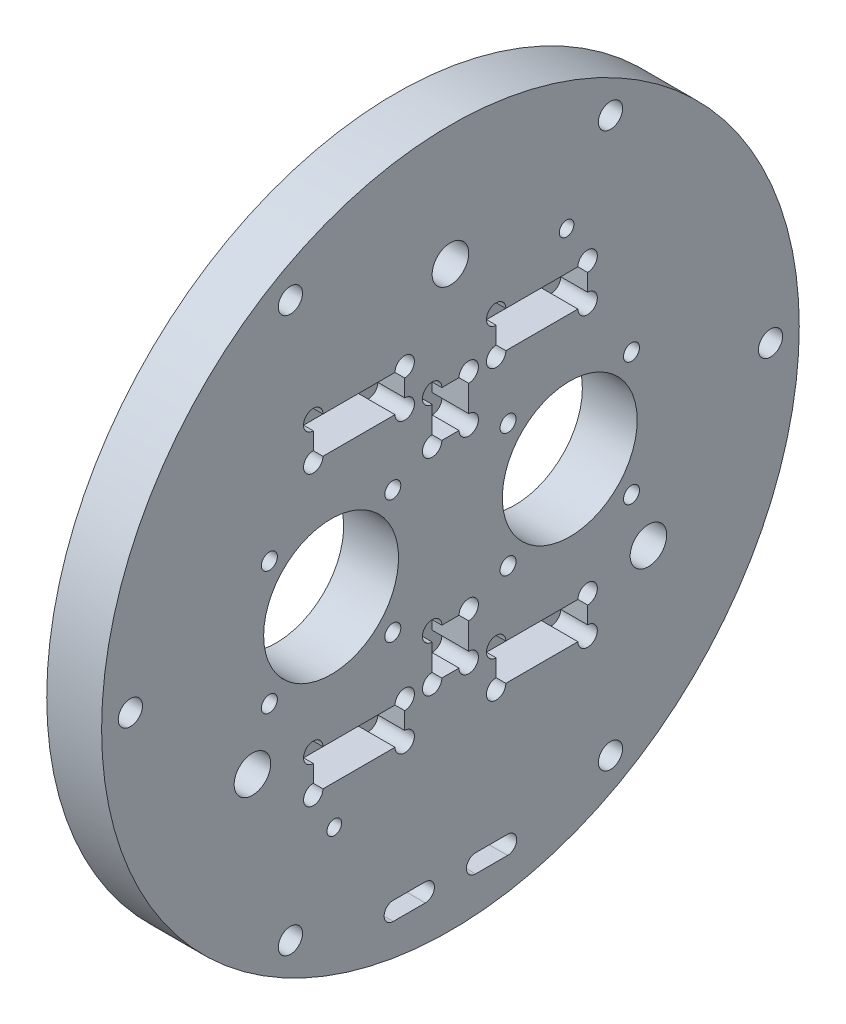
from build123d import *

# Parameters (mm, degrees)
SKETCH1_R           = 76.29
SKETCH1_R_2         = 4
SKETCH1_R_3         = 14.75
SKETCH1_R_4         = 1.75
BOSS_EXTRUDE1_DEPTH = 12
SKETCH2_W           = 20
SKETCH2_H           = 8
SKETCH2_W_2         = 8
SKETCH2_H_2         = 10
SKETCH2_W_3         = 7
SKETCH2_H_3         = 4
CUT_EXTRUDE1_DEPTH  = 8
CUT_EXTRUDE2_REACH  = 110.556
SKETCH3_R           = 2.65
SKETCH4_R           = 2.121320344
SKETCH4_R_2         = 2
CUT_EXTRUDE3_DEPTH  = 8
CUT_EXTRUDE4_REACH  = 110.556
SKETCH5_R           = 1.6


with BuildPart() as part:
    # Sketch1 → Boss-Extrude1 (new body)
    with BuildSketch(Plane(origin=(0, 0, 0), x_dir=(0, 0, -1), z_dir=(1, 0, 0))):
        Circle(SKETCH1_R)
        with Locations((0, 50)):
            Circle(SKETCH1_R_2, mode=Mode.SUBTRACT)
        with Locations((43.301270189, -25)):
            Circle(SKETCH1_R_2, mode=Mode.SUBTRACT)
        with Locations((-43.301270189, -25)):
            Circle(SKETCH1_R_2, mode=Mode.SUBTRACT)
        with Locations((26.1, 0)):
            Circle(SKETCH1_R_3, mode=Mode.SUBTRACT)
        with Locations(Location((-26.1, 0, 0), (0, 0, 180))):
            Circle(SKETCH1_R_3, mode=Mode.SUBTRACT)
        with Locations((39.596900686, 13.496900686)):
            Circle(SKETCH1_R_4, mode=Mode.SUBTRACT)
        with Locations((39.596900686, -13.496900686)):
            Circle(SKETCH1_R_4, mode=Mode.SUBTRACT)
        with Locations((12.603099314, -13.496900686)):
            Circle(SKETCH1_R_4, mode=Mode.SUBTRACT)
        with Locations((12.603099314, 13.496900686)):
            Circle(SKETCH1_R_4, mode=Mode.SUBTRACT)
        with Locations(Location((-39.596900686, -13.496900686, 0), (0, 0, 180))):
            Circle(SKETCH1_R_4, mode=Mode.SUBTRACT)
        with Locations(Location((-12.603099314, -13.496900686, 0), (0, 0, 180))):
            Circle(SKETCH1_R_4, mode=Mode.SUBTRACT)
        with Locations(Location((-12.603099314, 13.496900686, 0), (0, 0, 180))):
            Circle(SKETCH1_R_4, mode=Mode.SUBTRACT)
        with Locations(Location((-39.596900686, 13.496900686, 0), (0, 0, 180))):
            Circle(SKETCH1_R_4, mode=Mode.SUBTRACT)
    extrude(amount=BOSS_EXTRUDE1_DEPTH)

    # Sketch2 → Cut-Extrude1 (cut)
    with BuildSketch(Plane(origin=(12, 0, 0), x_dir=(0, 0, -1), z_dir=(1, 0, 0))):
        with Locations((20, -31.5)):
            Rectangle(SKETCH2_W, SKETCH2_H)
        with Locations((-20, -31.5)):
            Rectangle(SKETCH2_W, SKETCH2_H)
        with Locations((-20, 31.5)):
            Rectangle(SKETCH2_W, SKETCH2_H)
        with Locations((20, 31.5)):
            Rectangle(SKETCH2_W, SKETCH2_H)
        with Locations((0, -22.5)):
            Rectangle(SKETCH2_W_2, SKETCH2_H_2)
        with Locations((0, 22.5)):
            Rectangle(SKETCH2_W_2, SKETCH2_H_2)
        with Locations((-9, -66.29)):
            Rectangle(SKETCH2_W_3, SKETCH2_H_3)
        with Locations((9, -66.29)):
            Rectangle(SKETCH2_W_3, SKETCH2_H_3)
    extrude(amount=-CUT_EXTRUDE1_DEPTH, mode=Mode.SUBTRACT)

    # Sketch3 → Cut-Extrude2 (cut, up to next)
    with BuildSketch(Plane.ZY, mode=Mode.PRIVATE) as cut_extrude2_sk1:
        with Locations((-70, 0)):
            Circle(SKETCH3_R)
    cut_extrude2_tool1 = extrude(cut_extrude2_sk1.sketch, amount=-CUT_EXTRUDE2_REACH, mode=Mode.PRIVATE) & part.part
    # Sketch3 → Cut-Extrude2 (cut, up to next)
    with BuildSketch(Plane.ZY, mode=Mode.PRIVATE) as cut_extrude2_sk2:
        with Locations((-35, 60.621778265)):
            Circle(SKETCH3_R)
    cut_extrude2_tool2 = extrude(cut_extrude2_sk2.sketch, amount=-CUT_EXTRUDE2_REACH, mode=Mode.PRIVATE) & part.part
    # Sketch3 → Cut-Extrude2 (cut, up to next)
    with BuildSketch(Plane.ZY, mode=Mode.PRIVATE) as cut_extrude2_sk3:
        with Locations((35, 60.621778265)):
            Circle(SKETCH3_R)
    cut_extrude2_tool3 = extrude(cut_extrude2_sk3.sketch, amount=-CUT_EXTRUDE2_REACH, mode=Mode.PRIVATE) & part.part
    # Sketch3 → Cut-Extrude2 (cut, up to next)
    with BuildSketch(Plane.ZY, mode=Mode.PRIVATE) as cut_extrude2_sk4:
        with Locations((70, 0)):
            Circle(SKETCH3_R)
    cut_extrude2_tool4 = extrude(cut_extrude2_sk4.sketch, amount=-CUT_EXTRUDE2_REACH, mode=Mode.PRIVATE) & part.part
    # Sketch3 → Cut-Extrude2 (cut, up to next)
    with BuildSketch(Plane.ZY, mode=Mode.PRIVATE) as cut_extrude2_sk5:
        with Locations((35, -60.621778265)):
            Circle(SKETCH3_R)
    cut_extrude2_tool5 = extrude(cut_extrude2_sk5.sketch, amount=-CUT_EXTRUDE2_REACH, mode=Mode.PRIVATE) & part.part
    # Sketch3 → Cut-Extrude2 (cut, up to next)
    with BuildSketch(Plane.ZY, mode=Mode.PRIVATE) as cut_extrude2_sk6:
        with Locations((-35, -60.621778265)):
            Circle(SKETCH3_R)
    cut_extrude2_tool6 = extrude(cut_extrude2_sk6.sketch, amount=-CUT_EXTRUDE2_REACH, mode=Mode.PRIVATE) & part.part
    add(cut_extrude2_tool1.solids().sort_by_distance((0, 0, -70))[0], mode=Mode.SUBTRACT)
    add(cut_extrude2_tool2.solids().sort_by_distance((0, 60.621778, -35))[0], mode=Mode.SUBTRACT)
    add(cut_extrude2_tool3.solids().sort_by_distance((0, 60.621778, 35))[0], mode=Mode.SUBTRACT)
    add(cut_extrude2_tool4.solids().sort_by_distance((0, 0, 70))[0], mode=Mode.SUBTRACT)
    add(cut_extrude2_tool5.solids().sort_by_distance((0, -60.621778, 35))[0], mode=Mode.SUBTRACT)
    add(cut_extrude2_tool6.solids().sort_by_distance((0, -60.621778, -35))[0], mode=Mode.SUBTRACT)

    # Sketch4 → Cut-Extrude3 (cut)
    with BuildSketch(Plane(origin=(12, 0, 0), x_dir=(0, 0, -1), z_dir=(1, 0, 0))):
        with Locations((-10, -35.5)):
            Circle(SKETCH4_R)
        with Locations((-10, -27.5)):
            Circle(SKETCH4_R)
        with Locations((-30, -27.5)):
            Circle(SKETCH4_R)
        with Locations((-30, -35.5)):
            Circle(SKETCH4_R)
        with Locations((12.5, -66.29)):
            Circle(SKETCH4_R_2)
        with Locations((5.5, -66.29)):
            Circle(SKETCH4_R_2)
        with Locations((-5.5, -66.29)):
            Circle(SKETCH4_R_2)
        with Locations((-12.5, -66.29)):
            Circle(SKETCH4_R_2)
        with Locations((10, -35.5)):
            Circle(SKETCH4_R)
        with Locations((10, -27.5)):
            Circle(SKETCH4_R)
        with Locations((30, -27.5)):
            Circle(SKETCH4_R)
        with Locations((30, -35.5)):
            Circle(SKETCH4_R)
        with Locations((4, -27.5)):
            Circle(SKETCH4_R)
        with Locations((-4, -27.5)):
            Circle(SKETCH4_R)
        with Locations((-4, -17.5)):
            Circle(SKETCH4_R)
        with Locations((4, -17.5)):
            Circle(SKETCH4_R)
        with Locations((4, 27.5)):
            Circle(SKETCH4_R)
        with Locations((-4, 27.5)):
            Circle(SKETCH4_R)
        with Locations((-4, 17.5)):
            Circle(SKETCH4_R)
        with Locations((4, 17.5)):
            Circle(SKETCH4_R)
        with Locations((10, 27.5)):
            Circle(SKETCH4_R)
        with Locations((10, 35.5)):
            Circle(SKETCH4_R)
        with Locations((30, 35.5)):
            Circle(SKETCH4_R)
        with Locations((30, 27.5)):
            Circle(SKETCH4_R)
        with Locations((-10, 35.5)):
            Circle(SKETCH4_R)
        with Locations((-10, 27.5)):
            Circle(SKETCH4_R)
        with Locations((-30, 27.5)):
            Circle(SKETCH4_R)
        with Locations((-30, 35.5)):
            Circle(SKETCH4_R)
    extrude(amount=-CUT_EXTRUDE3_DEPTH, mode=Mode.SUBTRACT)

    # Sketch5 → Cut-Extrude4 (cut, up to next)
    with BuildSketch(Plane.ZY, mode=Mode.PRIVATE) as cut_extrude4_sk1:
        with Locations((25.403411844, -44)):
            Circle(SKETCH5_R)
    cut_extrude4_tool1 = extrude(cut_extrude4_sk1.sketch, amount=-CUT_EXTRUDE4_REACH, mode=Mode.PRIVATE) & part.part
    # Sketch5 → Cut-Extrude4 (cut, up to next)
    with BuildSketch(Plane.ZY, mode=Mode.PRIVATE) as cut_extrude4_sk2:
        with Locations((-25.403411844, 44)):
            Circle(SKETCH5_R)
    cut_extrude4_tool2 = extrude(cut_extrude4_sk2.sketch, amount=-CUT_EXTRUDE4_REACH, mode=Mode.PRIVATE) & part.part
    add(cut_extrude4_tool1.solids().sort_by_distance((0, -44, 25.403412))[0], mode=Mode.SUBTRACT)
    add(cut_extrude4_tool2.solids().sort_by_distance((0, 44, -25.403412))[0], mode=Mode.SUBTRACT)


solid = part.part
